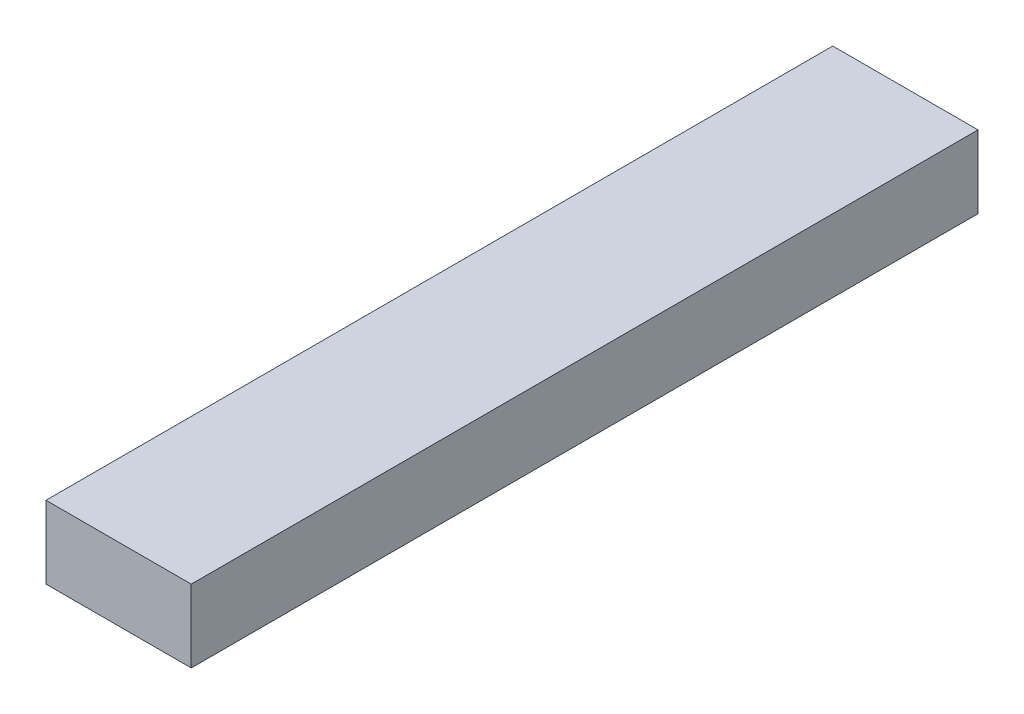
from build123d import *

# Parameters (mm, degrees)
ESQUISSE1_W        = 48
ESQUISSE1_H        = 260
BOSS_EXTRU_1_DEPTH = 24


with BuildPart() as part:
    # Esquisse1 → Boss.-Extru.1 (new body)
    with BuildSketch(Plane(origin=(0, 0, 0), x_dir=(1, 0, 0), z_dir=(0, 1, 0))):
        Rectangle(ESQUISSE1_W, ESQUISSE1_H)
    extrude(amount=BOSS_EXTRU_1_DEPTH)


solid = part.part
